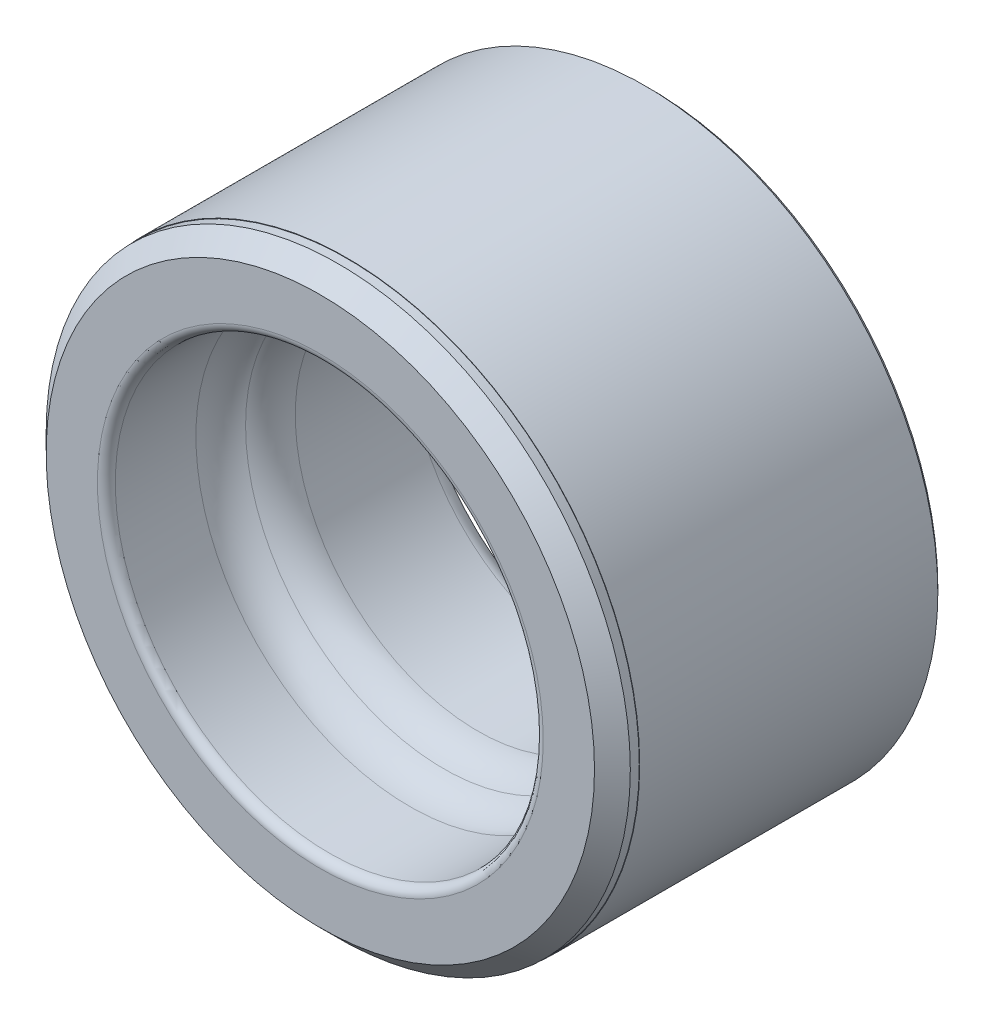
from build123d import *


with BuildPart() as part:
    # Sketch1 → Revolve1 (revolve)
    with BuildSketch(Plane(origin=(0, 0, 0), x_dir=(0, 0, -1), z_dir=(1, 0, 0)), mode=Mode.PRIVATE) as revolve1_sk:
        with BuildLine():
            Line((2, 32.625), (3, 32.625))
            Line((3, 32.625), (3, 32.675))
            Line((3, 32.675), (36.3, 32.675))
            Line((36.3, 32.675), (36.8, 32.175))
            Line((36.8, 32.175), (36.8, 29.5))
            Line((36.8, 29.5), (32.12346282, 21.4))
            ThreePointArc((32.12346282, 21.4), (31.391412012, 20.667949192), (30.391412012, 20.4))
            Line((30.391412012, 20.4), (17.599342077, 20.4))
            ThreePointArc((17.599342077, 20.4), (15.50769201, 20.858524469), (13.799671038, 22.15))
            ThreePointArc((13.799671038, 22.15), (12.091650066, 23.441475531), (10, 23.9))
            Line((10, 23.9), (1, 23.9))
            ThreePointArc((1, 23.9), (0.292893219, 24.192893219), (0, 24.9))
            Line((0, 24.9), (0, 30.625))
            Line((0, 30.625), (2, 32.625))
        make_face()
    revolve(revolve1_sk.sketch.rotate(Axis((0, 0, 0), (0, 0, -1)), 90), axis=Axis((0, 0, 0), (0, 0, -1)))


solid = part.part
